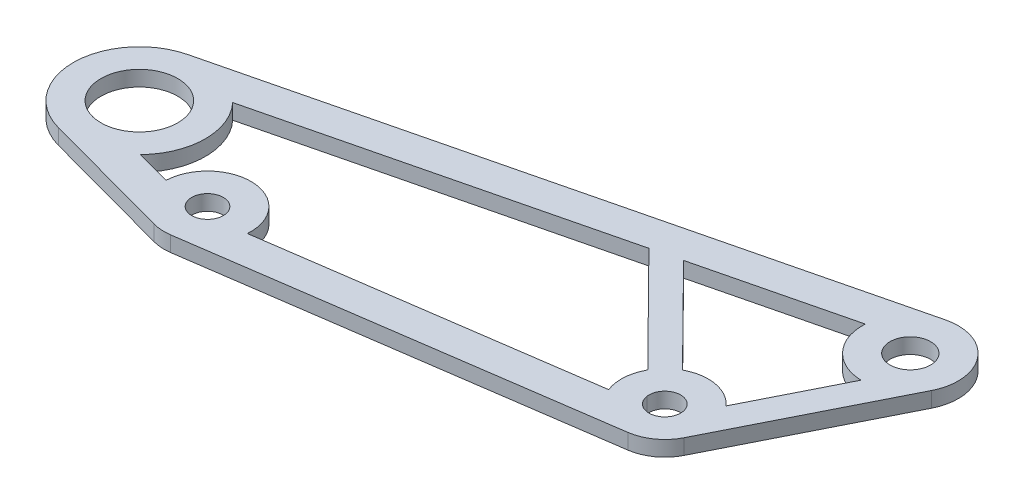
from build123d import *

# Parameters (mm, degrees)
SKETCH1_R           = 3.2639
SKETCH1_R_2         = 7.9375
SKETCH1_R_3         = 4.191
BOSS_EXTRUDE4_DEPTH = 3.175


with BuildPart() as part:
    # Sketch1 → Boss-Extrude4 (new body)
    with BuildSketch(Plane(origin=(0, 0, 0), x_dir=(1, 0, 0), z_dir=(0, 1, 0))):
        with BuildLine():
            Line((27.261215437, -20.782448937), (109.864793621, -8.887225298))
            ThreePointArc((109.864793621, -8.887225298), (113.829824864, -7.2878294), (116.60566957, -4.036025875))
            Line((116.60566957, -4.036025875), (133.726592386, 29.98785526))
            ThreePointArc((133.726592386, 29.98785526), (132.627611185, 40.61059676), (122.521356715, 44.06226552))
            Line((122.521356715, 44.06226552), (-3.247611444, 13.260609947))
            ThreePointArc((-3.247611444, 13.260609947), (-13.651443786, 0.16981992), (-3.576471569, -13.175720374))
            Line((-3.576471569, -13.175720374), (23.629267956, -20.560557875))
            ThreePointArc((23.629267956, -20.560557875), (25.433883661, -20.857413504), (27.261215437, -20.782448937))
        make_face()
        with Locations(Location((25.981421816, -11.895223639, 0), (0, 0, 270))):
            Circle(SKETCH1_R, mode=Mode.SUBTRACT)
        with Locations(Location((0, 0, 0), (0, 0, 270))):
            Circle(SKETCH1_R_2, mode=Mode.SUBTRACT)
        with BuildLine():
            ThreePointArc((100.723144875, 4.337266328), (99.62721378, 0.615395192), (100.203869733, -3.221381793))
            Line((100.203869733, -3.221381793), (34.930946987, -12.620926349))
            ThreePointArc((34.930946987, -12.620926349), (26.528959971, -2.933033774), (17.010113752, -11.526066709))
            Line((17.010113752, -11.526066709), (9.750952301, -9.555610157))
            ThreePointArc((9.750952301, -9.555610157), (13.651443786, -0.16981992), (9.985636063, 9.310092839))
            Line((9.985636063, 9.310092839), (79.071831614, 26.229760952))
            Line((79.071831614, 26.229760952), (100.723144875, 4.337266328))
        make_face(mode=Mode.SUBTRACT)
        with Locations(Location((108.585, 0, 0), (0, 0, 270))):
            Circle(SKETCH1_R, mode=Mode.SUBTRACT)
        with BuildLine():
            Line((104.335087932, 7.90941797), (84.823475635, 27.638376771))
            Line((84.823475635, 27.638376771), (114.98908268, 35.026134276))
            ThreePointArc((114.98908268, 35.026134276), (117.570132445, 27.752761279), (124.58688197, 24.538885311))
            Line((124.58688197, 24.538885311), (115.260501822, 6.004858086))
            ThreePointArc((115.260501822, 6.004858086), (110.126982004, 8.845503757), (104.335087932, 7.90941797))
        make_face(mode=Mode.SUBTRACT)
        with Locations(Location((124.877763158, 34.440613651, 0), (0, 0, 270))):
            Circle(SKETCH1_R_3, mode=Mode.SUBTRACT)
    extrude(amount=-BOSS_EXTRUDE4_DEPTH)


solid = part.part
